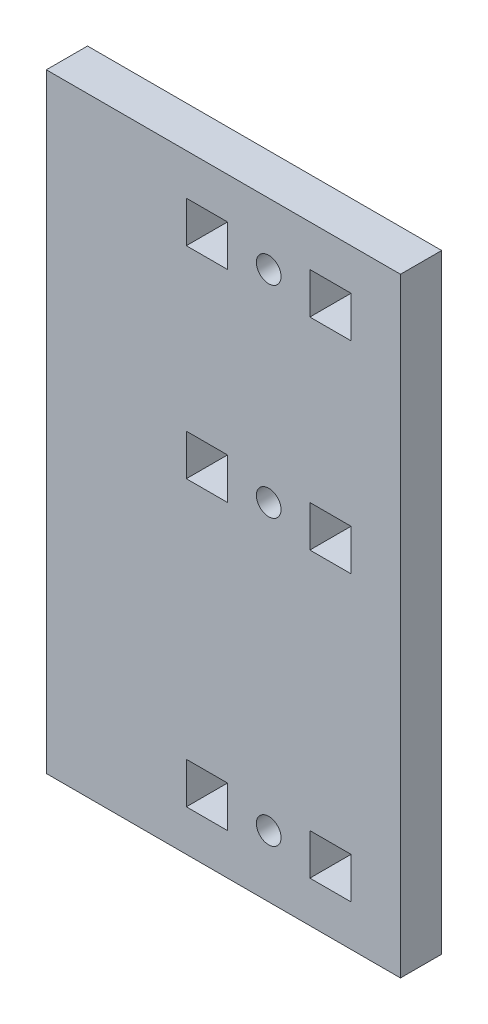
from build123d import *

# Parameters (mm, degrees)
SKETCH1_W           = 43
SKETCH1_H           = 74
SKETCH1_R           = 1.5
SKETCH1_W_2         = 5
SKETCH1_H_2         = 5
BOSS_EXTRUDE1_DEPTH = 5


with BuildPart() as part:
    # Sketch1 → Boss-Extrude1 (new body)
    with BuildSketch(Plane.XY):
        with Locations((-5.5, -5)):
            Rectangle(SKETCH1_W, SKETCH1_H)
        Circle(SKETCH1_R, mode=Mode.SUBTRACT)
        with Locations((0, 24.5)):
            Circle(SKETCH1_R, mode=Mode.SUBTRACT)
        with Locations((0, -34.5)):
            Circle(SKETCH1_R, mode=Mode.SUBTRACT)
        with Locations((-7.5, 0)):
            Rectangle(SKETCH1_W_2, SKETCH1_H_2, mode=Mode.SUBTRACT)
        with Locations((7.5, 0)):
            Rectangle(SKETCH1_W_2, SKETCH1_H_2, mode=Mode.SUBTRACT)
        with Locations((-7.5, 24.5)):
            Rectangle(SKETCH1_W_2, SKETCH1_H_2, mode=Mode.SUBTRACT)
        with Locations((7.5, 24.5)):
            Rectangle(SKETCH1_W_2, SKETCH1_H_2, mode=Mode.SUBTRACT)
        with Locations((-7.5, -34.5)):
            Rectangle(SKETCH1_W_2, SKETCH1_H_2, mode=Mode.SUBTRACT)
        with Locations((7.5, -34.5)):
            Rectangle(SKETCH1_W_2, SKETCH1_H_2, mode=Mode.SUBTRACT)
    extrude(amount=BOSS_EXTRUDE1_DEPTH)


solid = part.part
